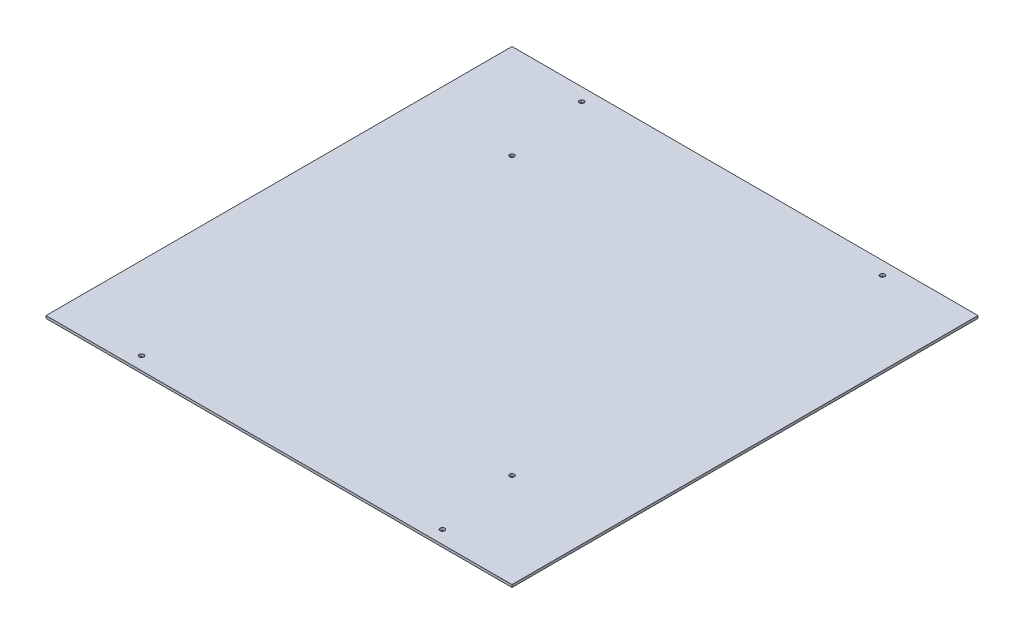
from build123d import *

# Parameters (mm, degrees)
SKETCH1_W           = 350
SKETCH1_H           = 350
BOSS_EXTRUDE1_DEPTH = 1.9
SKETCH2_R           = 1.75
CUT_EXTRUDE2_DEPTH  = 495.978393468


with BuildPart() as part:
    # Sketch1 → Boss-Extrude1 (new body)
    with BuildSketch(Plane(origin=(0, 0, 0), x_dir=(1, 0, 0), z_dir=(0, 1, 0))):
        with Locations((175, 175)):
            Rectangle(SKETCH1_W, SKETCH1_H)
    extrude(amount=BOSS_EXTRUDE1_DEPTH)

    # Sketch2 → Cut-Extrude2 (cut, through all)
    with BuildSketch(Plane(origin=(0, 1.9, 0), x_dir=(1, 0, 0), z_dir=(0, 1, 0))):
        with Locations(Location((62, 340.25, 0), (0, 0, 270))):
            Circle(SKETCH2_R)
        with Locations(Location((288, 340.25, 0), (0, 0, 270))):
            Circle(SKETCH2_R)
        with Locations(Location((62, 9.75, 0), (0, 0, 270))):
            Circle(SKETCH2_R)
        with Locations(Location((288, 9.75, 0), (0, 0, 270))):
            Circle(SKETCH2_R)
        with Locations(Location((71, 279, 0), (0, 0, 270))):
            Circle(SKETCH2_R)
        with Locations(Location((279.007361649, 71, 0), (0, 0, 270))):
            Circle(SKETCH2_R)
    extrude(amount=-CUT_EXTRUDE2_DEPTH, mode=Mode.SUBTRACT)


solid = part.part
